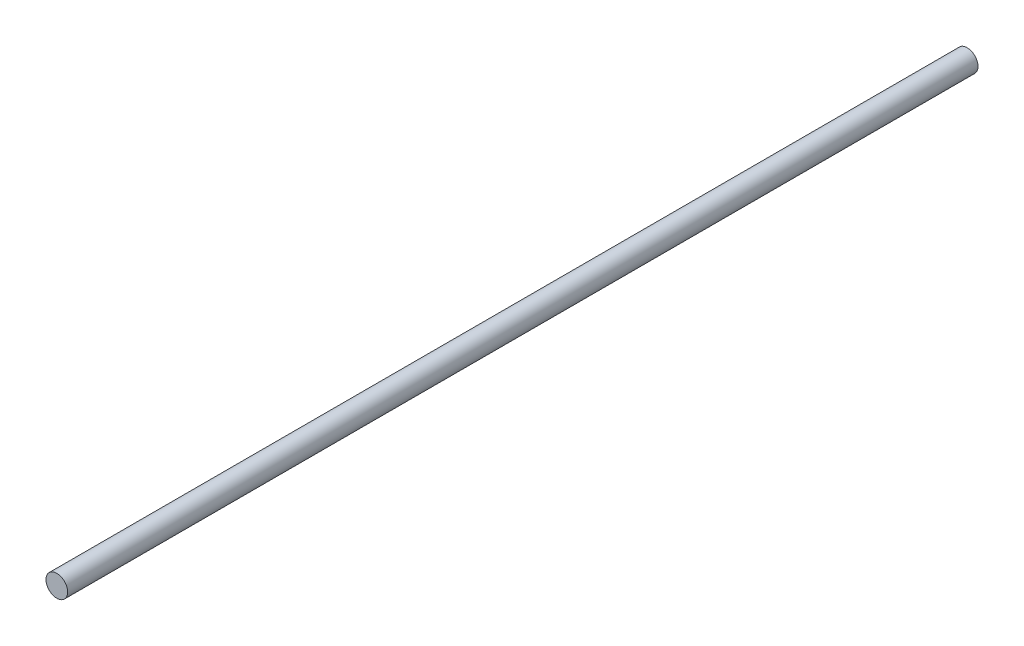
from build123d import *

# Parameters (mm, degrees)
SKETCH1_R           = 4.445
BOSS_EXTRUDE1_DEPTH = 373.888


with BuildPart() as part:
    # Sketch1 → Boss-Extrude1 (new body)
    with BuildSketch(Plane.XY):
        Circle(SKETCH1_R)
    extrude(amount=BOSS_EXTRUDE1_DEPTH)


solid = part.part
